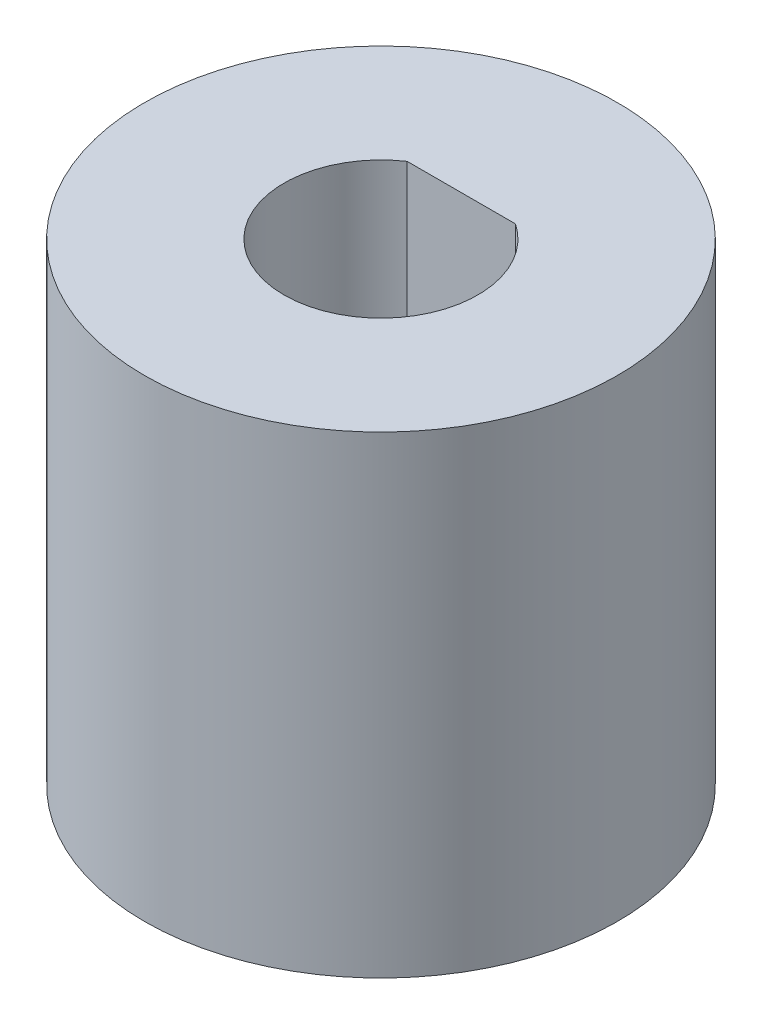
from build123d import *

# Parameters (mm, degrees)
SKETCH1_R           = 7.5
BOSS_EXTRUDE1_DEPTH = 15
CUT_EXTRUDE1_DEPTH  = 10


with BuildPart() as part:
    # Sketch1 → Boss-Extrude1 (new body)
    with BuildSketch(Plane(origin=(0, 0, 0), x_dir=(1, 0, 0), z_dir=(0, 1, 0))):
        with Locations(Location((0, 0, 0), (0, 0, 270))):
            Circle(SKETCH1_R)
    extrude(amount=BOSS_EXTRUDE1_DEPTH)

    # Sketch2 → Cut-Extrude1 (cut)
    with BuildSketch(Plane(origin=(0, 15, 0), x_dir=(1, 0, 0), z_dir=(0, 1, 0))):
        with BuildLine():
            Line((1.718465886, 2.55), (-1.718465886, 2.55))
            ThreePointArc((-1.718465886, 2.55), (0, -3.075), (1.718465886, 2.55))
        make_face()
    extrude(amount=-CUT_EXTRUDE1_DEPTH, mode=Mode.SUBTRACT)


solid = part.part
